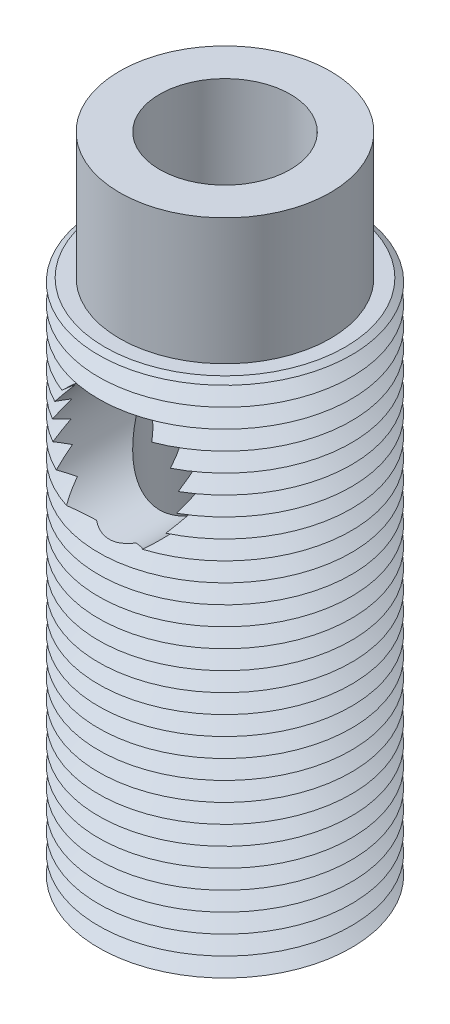
from build123d import *

# Parameters (mm, degrees)
CUT_EXTRUDE_1_DEPTH      = 33.14031736
CUT_EXTRUDE_1_DEPTH_BACK = 33.14031736
SKETCH_3_R               = 3
SKETCH_4_R               = 3.1
CUT_EXTRUDE_2_DEPTH      = 25
CUT_EXTRUDE_3_DEPTH      = 6


with BuildPart() as part:
    # 草图1 → 旋转1 (revolve)
    with BuildSketch(Plane.XY, mode=Mode.PRIVATE) as revolve_1_sk:
        Polygon((0, 0), (0, 31), (5, 31), (5, 25), (5.703375331, 25), (6, 24.82151097), (5.25, 24.370210771), (6, 23.918910571), (5.25, 23.467610372), (6, 23.016310172), (5.25, 22.565009973), (6, 22.113709773), (5.25, 21.662409574), (6, 21.211109374), (5.25, 20.759809175), (6, 20.308508976), (5.25, 19.857208776), (6, 19.405908577), (5.25, 18.954608377), (6, 18.503308178), (5.25, 18.052007978), (6, 17.600707779), (5.25, 17.149407579), (6, 16.69810738), (5.25, 16.24680718), (6, 15.795506981), (5.25, 15.344206782), (6, 14.892906582), (5.25, 14.441606383), (6, 13.990306183), (5.25, 13.539005984), (6, 13.087705784), (5.25, 12.636405585), (6, 12.185105385), (5.25, 11.733805186), (6, 11.282504986), (5.25, 10.831204787), (6, 10.379904588), (5.25, 9.928604388), (6, 9.477304189), (5.25, 9.026003989), (6, 8.57470379), (5.25, 8.12340359), (6, 7.672103391), (5.25, 7.220803191), (6, 6.769502992), (5.25, 6.318202792), (6, 5.866902593), (5.25, 5.415602393), (6, 4.964302194), (5.25, 4.513001995), (6, 4.061701795), (5.25, 3.610401596), (6, 3.159101396), (5.25, 2.707801197), (6, 2.256500997), (5.25, 1.805200798), (6, 1.353900598), (5.25, 0.902600399), (6, 0.451300199), (5.25, 0), align=None)
    revolve(revolve_1_sk.sketch.rotate(Axis((0, 0, 0), (0, 1, 0)), 90), axis=Axis((0, 0, 0), (0, 1, 0)))

    # 草图3 → 切除-拉伸1 (cut, two sides: drawn at the far end of the back side and taken through both)
    with BuildSketch(Plane.XY.offset(-CUT_EXTRUDE_1_DEPTH_BACK)):
        with Locations(Location((0, 20, 0), (0, 0, 357.27186053))):
            Circle(SKETCH_3_R)
    extrude(amount=CUT_EXTRUDE_1_DEPTH + CUT_EXTRUDE_1_DEPTH_BACK, mode=Mode.SUBTRACT)

    # 草图4 → 切除-拉伸2 (cut)
    with BuildSketch(Plane(origin=(0, 31, 0), x_dir=(1, 0, 0), z_dir=(0, 1, 0))):
        with Locations(Location((0, 0, 0), (0, 0, 270))):
            Circle(SKETCH_4_R)
    extrude(amount=-CUT_EXTRUDE_2_DEPTH, mode=Mode.SUBTRACT)

    # 草图5 → 切除-拉伸3 (cut)
    with BuildSketch(Plane.XZ):
        Polygon((3.579571669, 0), (1.789785834, 3.1), (-1.789785834, 3.1), (-3.579571669, 0), (-1.789785834, -3.1), (1.789785834, -3.1), align=None)
    extrude(amount=-CUT_EXTRUDE_3_DEPTH, mode=Mode.SUBTRACT)


solid = part.part
